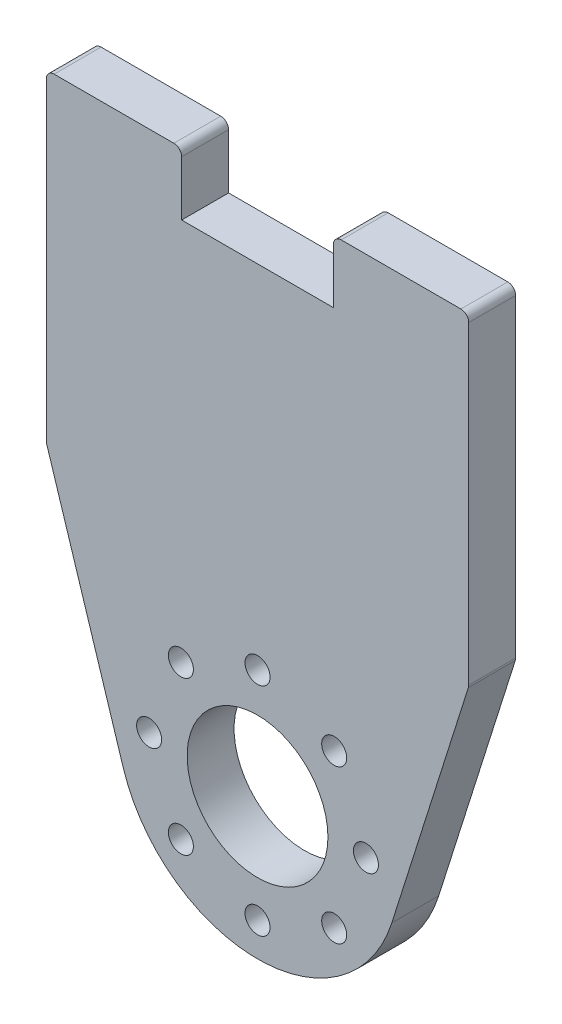
from build123d import *

# Parameters (mm, degrees)
ESQUISSE1_R        = 0.8
BOSS_EXTRU_1_DEPTH = 3
CONG_1_R           = 0.5


with BuildPart() as part:
    # Esquisse1 → Boss.-Extru.1 (new body)
    # profile 1 of 4: a face of its own
    with BuildSketch(Plane.XY):
        with BuildLine():
            Line((-13.5, 4), (-13.5, 0))
            Line((-13.5, 0), (-13.5, -16.644680961))
            Line((-13.5, -16.644680961), (-8.580913976, -32.195227318))
            ThreePointArc((-8.580913976, -32.195227318), (-7.260492881, -24.162449633), (0, -20.4808369))
            Line((0, -20.4808369), (0, 0))
            Line((0, 0), (-4.85, 0))
            Line((-4.85, 0), (-4.85, 4))
            Line((-4.85, 4), (-13.5, 4))
        make_face()
    # profile 2 of 4: a face of its own
    with BuildSketch(Plane.XY):
        with BuildLine():
            Line((0, 0), (0, -20.4808369))
            ThreePointArc((0, -20.4808369), (6.363961031, -23.11687587), (9, -29.4808369))
            ThreePointArc((9, -29.4808369), (8.894611453, -30.85411295), (8.580913976, -32.195227318))
            Line((8.580913976, -32.195227318), (13.5, -16.644680961))
            Line((13.5, -16.644680961), (13.5, 0))
            Line((13.5, 0), (13.5, 4))
            Line((13.5, 4), (4.85, 4))
            Line((4.85, 4), (4.85, 0))
            Line((4.85, 0), (0, 0))
        make_face()
    # profile 3 of 4: a face of its own
    with BuildSketch(Plane.XY):
        with BuildLine():
            ThreePointArc((9, -29.4808369), (6.363961031, -23.11687587), (0, -20.4808369))
            Line((0, -20.4808369), (0, -21.6808369))
            ThreePointArc((0, -21.6808369), (0.565685425, -21.915151475), (0.8, -22.4808369))
            ThreePointArc((0.8, -22.4808369), (0.565685425, -23.046522325), (0, -23.2808369))
            Line((0, -23.2808369), (0, -24.9808369))
            ThreePointArc((0, -24.9808369), (3.181980515, -26.298856385), (4.5, -29.4808369))
            ThreePointArc((4.5, -29.4808369), (3.181980515, -32.662817416), (0, -33.9808369))
            Line((0, -33.9808369), (0, -35.539601481))
            ThreePointArc((0, -35.539601481), (0.565685425, -35.773916056), (0.8, -36.339601481))
            ThreePointArc((0.8, -36.339601481), (0.565685425, -36.905286906), (0, -37.139601481))
            Line((0, -37.139601481), (0, -38.4808369))
            ThreePointArc((0, -38.4808369), (5.318387267, -36.741329781), (8.580913976, -32.195227318))
            ThreePointArc((8.580913976, -32.195227318), (8.894611453, -30.85411295), (9, -29.4808369))
        make_face()
        with Locations((4.899813207, -34.310032397)):
            Circle(ESQUISSE1_R, mode=Mode.SUBTRACT)
        with Locations((6.92938229, -29.410219191)):
            Circle(ESQUISSE1_R, mode=Mode.SUBTRACT)
        with Locations((4.899813207, -24.510405984)):
            Circle(ESQUISSE1_R, mode=Mode.SUBTRACT)
    # profile 4 of 4: a face of its own
    with BuildSketch(Plane.XY):
        with BuildLine():
            ThreePointArc((0, -20.4808369), (-7.260492881, -24.162449633), (-8.580913976, -32.195227318))
            ThreePointArc((-8.580913976, -32.195227318), (-5.318387267, -36.741329781), (0, -38.4808369))
            Line((0, -38.4808369), (0, -37.139601481))
            ThreePointArc((0, -37.139601481), (-0.8, -36.339601481), (0, -35.539601481))
            Line((0, -35.539601481), (0, -33.9808369))
            ThreePointArc((0, -33.9808369), (-4.5, -29.4808369), (0, -24.9808369))
            Line((0, -24.9808369), (0, -23.2808369))
            ThreePointArc((0, -23.2808369), (-0.8, -22.4808369), (0, -21.6808369))
            Line((0, -21.6808369), (0, -20.4808369))
        make_face()
        with Locations((-6.92938229, -29.410219191)):
            Circle(ESQUISSE1_R, mode=Mode.SUBTRACT)
        with Locations((-4.899813207, -34.310032397)):
            Circle(ESQUISSE1_R, mode=Mode.SUBTRACT)
        with Locations((-4.899813207, -24.510405984)):
            Circle(ESQUISSE1_R, mode=Mode.SUBTRACT)
    extrude(amount=BOSS_EXTRU_1_DEPTH)

    # Congé1
    cong_1_edges = [part.edges().sort_by_distance(p)[0] for p in [
        (-13.5, -16.644680961, 1.5),
        (-13.5, 4, 1.5),
        (-4.85, 4, 1.5),
        (4.85, 4, 1.5),
        (13.5, 4, 1.5),
        (13.5, -16.644680961, 1.5),
    ]]
    fillet(cong_1_edges, radius=CONG_1_R)


solid = part.part
